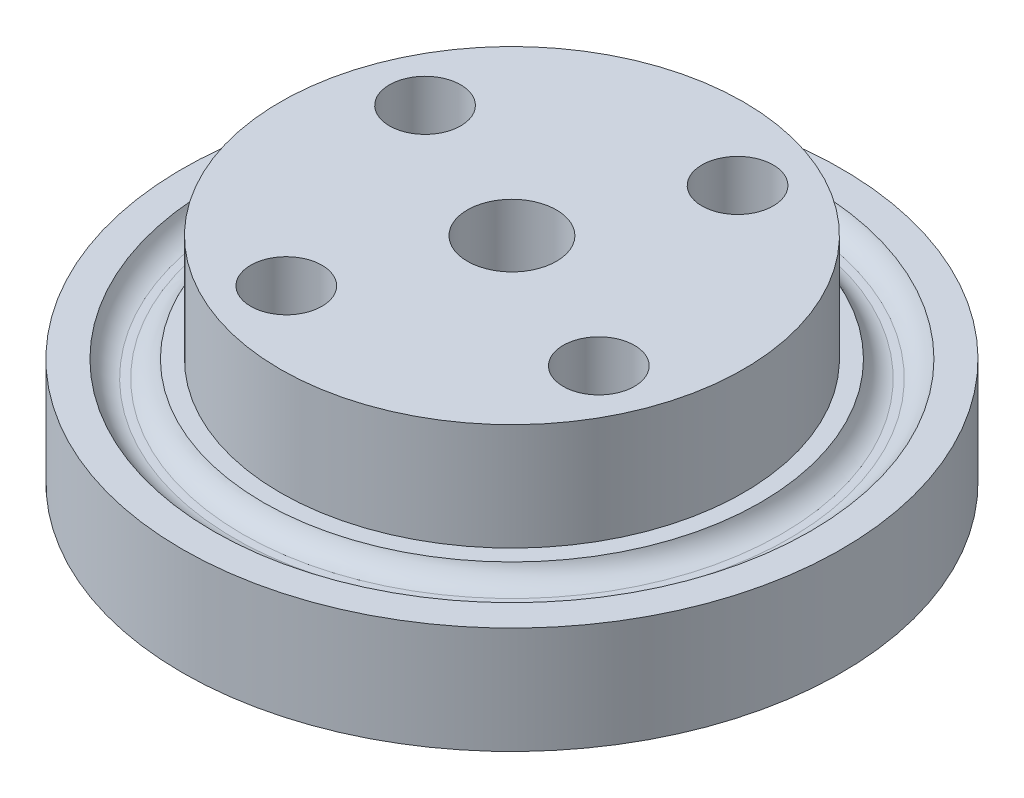
from build123d import *

# Parameters (mm, degrees)
SKETCH_1_R          = 18.5
EXTRUDE_1_DEPTH     = 6
SKETCH_6_R          = 13
EXTRUDE_2_DEPTH     = 6
SKETCH_8_R          = 2.5
SKETCH_8_R_2        = 2
CUT_EXTRUDE_1_DEPTH = 29.783675971


with BuildPart() as part:
    # Эскиз1 → Вытянуть1 (new body)
    with BuildSketch(Plane(origin=(0, 0, 0), x_dir=(1, 0, 0), z_dir=(0, 1, 0))):
        with Locations(Location((0, 0, 0), (0, 0, 270))):
            Circle(SKETCH_1_R)
    extrude(amount=EXTRUDE_1_DEPTH)

    # Вырез-По траектории1: sweep along a path in Эскиз3
    with BuildLine(Plane.XZ) as sweep_1_path:
        CenterArc((0, 0), 14.780391545, 0, 360)
    # Эскиз2 → Вырез-По траектории1 (sweep, cut)
    with BuildSketch(Plane.XY):
        with BuildLine():
            Line((-16.280391545, 0), (-13.280391545, 0))
            ThreePointArc((-13.280391545, 0), (-13.774210945, 0.666341341), (-14.533760145, 0.999438018))
            Line((-14.533760145, 0.999438018), (-15.027022944, 0.999438018))
            ThreePointArc((-15.027022944, 0.999438018), (-15.786572145, 0.666341341), (-16.280391545, 0))
        make_face()
    sweep(path=sweep_1_path.line, mode=Mode.SUBTRACT)

    # Вырез-По траектории2: sweep along a path in Эскиз5
    with BuildLine(Plane(origin=(0, 6, 0), x_dir=(1, 0, 0), z_dir=(0, 1, 0))) as sweep_2_path:
        CenterArc((0, 0), 15.352645825, 0, 360)
    # Эскиз4 → Вырез-По траектории2 (sweep, cut)
    with BuildSketch(Plane.XY):
        with BuildLine():
            Line((-16.751489622, 6), (-13.953802029, 6))
            ThreePointArc((-13.953802029, 6), (-14.416118652, 5.369797379), (-15.13270948, 5.05772433))
            Line((-15.13270948, 5.05772433), (-15.572582171, 5.05772433))
            ThreePointArc((-15.572582171, 5.05772433), (-16.289172999, 5.369797379), (-16.751489622, 6))
        make_face()
    sweep(path=sweep_2_path.line, mode=Mode.SUBTRACT)

    # Эскиз6 → Вытянуть2 (add)
    with BuildSketch(Plane(origin=(0, 6, 0), x_dir=(1, 0, 0), z_dir=(0, 1, 0))):
        with Locations(Location((0, 0, 0), (0, 0, 270))):
            Circle(SKETCH_6_R)
    extrude(amount=EXTRUDE_2_DEPTH)

    # Эскиз8 → Вырез-Вытянуть1 (cut, through all)
    with BuildSketch(Plane(origin=(0, 12, 0), x_dir=(1, 0, 0), z_dir=(0, 1, 0))):
        with Locations(Location((0, 0, 0), (0, 0, 270))):
            Circle(SKETCH_8_R)
        with Locations(Location((-3.894424366, -8.770838888, 0), (0, 0, 270))):
            Circle(SKETCH_8_R_2)
        with Locations(Location((8.770838888, -3.894424366, 0), (0, 0, 270))):
            Circle(SKETCH_8_R_2)
        with Locations(Location((3.894424366, 8.770838888, 0), (0, 0, 270))):
            Circle(SKETCH_8_R_2)
        with Locations(Location((-8.770838888, 3.894424366, 0), (0, 0, 270))):
            Circle(SKETCH_8_R_2)
    extrude(amount=-CUT_EXTRUDE_1_DEPTH, mode=Mode.SUBTRACT)


solid = part.part
